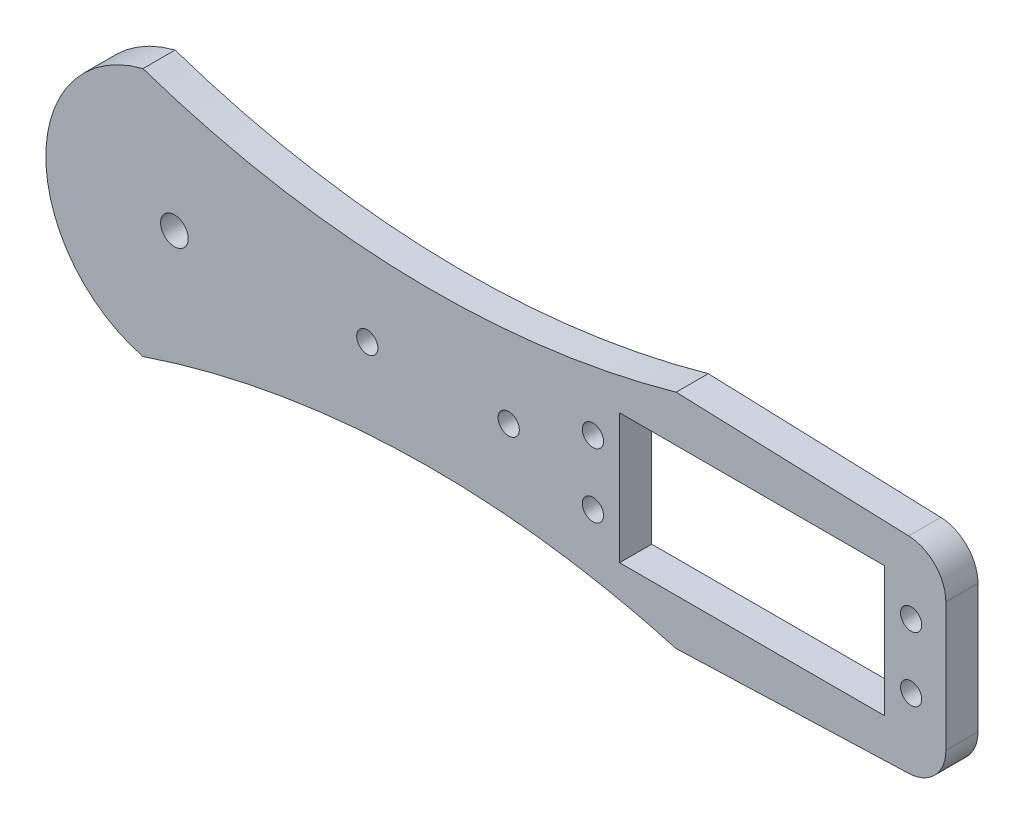
from build123d import *

# Parameters (mm, degrees)
ESKIZ_KONTUR_W        = 41.2
ESKIZ_KONTUR_H        = 20.2
PLASTINA_DEPTH        = 5
OTVERSTIYA_DEPTH      = 122.659652126
OTVERSTIYA_DEPTH_BACK = 122.659652126
ESKIZ_OTVERSTIYA_R    = 1.65
ESKIZ_OTVERSTIYA_R_2  = 2.15


with BuildPart() as part:
    # Eskiz_kontur → Plastina (new body)
    with BuildSketch(Plane.XY):
        with BuildLine():
            Line((78.04349, 17.26807), (114.2094, 15.99634))
            ThreePointArc((114.2094, 15.99634), (118.316039529, 14.167943464), (119.999997488, 9.999993404))
            Line((119.999997488, 9.999993404), (119.999997488, -10.000006596))
            ThreePointArc((119.999997488, -10.000006596), (118.31603808, -14.167953985), (114.2094, -15.996349022))
            Line((114.2094, -15.996349022), (78.04349, -17.268079022))
            ThreePointArc((78.04349, -17.268079022), (36.414907375, -12.045919499), (-4.891710116, -19.392564511))
            ThreePointArc((-4.891710116, -19.392564511), (-20.000005367, -4.511e-06), (-4.891710116, 19.392555489))
            ThreePointArc((-4.891710116, 19.392555489), (36.414907375, 12.045910477), (78.04349, 17.26807))
        make_face()
        with Locations((89.85, 0)):
            Rectangle(ESKIZ_KONTUR_W, ESKIZ_KONTUR_H, mode=Mode.SUBTRACT)
    extrude(amount=PLASTINA_DEPTH)

    # Eskiz_otverstiya → Otverstiya (cut, two sides: drawn at the far end of the back side and taken through both)
    with BuildSketch(Plane.XY.offset(-OTVERSTIYA_DEPTH_BACK)):
        with Locations((65.1, -5)):
            Circle(ESKIZ_OTVERSTIYA_R)
        with Locations((114.6, -5)):
            Circle(ESKIZ_OTVERSTIYA_R)
        Circle(ESKIZ_OTVERSTIYA_R_2)
        with Locations((30, 0)):
            Circle(ESKIZ_OTVERSTIYA_R)
        with Locations((52, 0)):
            Circle(ESKIZ_OTVERSTIYA_R)
        with Locations((65.1, 5)):
            Circle(ESKIZ_OTVERSTIYA_R)
        with Locations((114.6, 5)):
            Circle(ESKIZ_OTVERSTIYA_R)
    extrude(amount=OTVERSTIYA_DEPTH + OTVERSTIYA_DEPTH_BACK, mode=Mode.SUBTRACT)


solid = part.part
